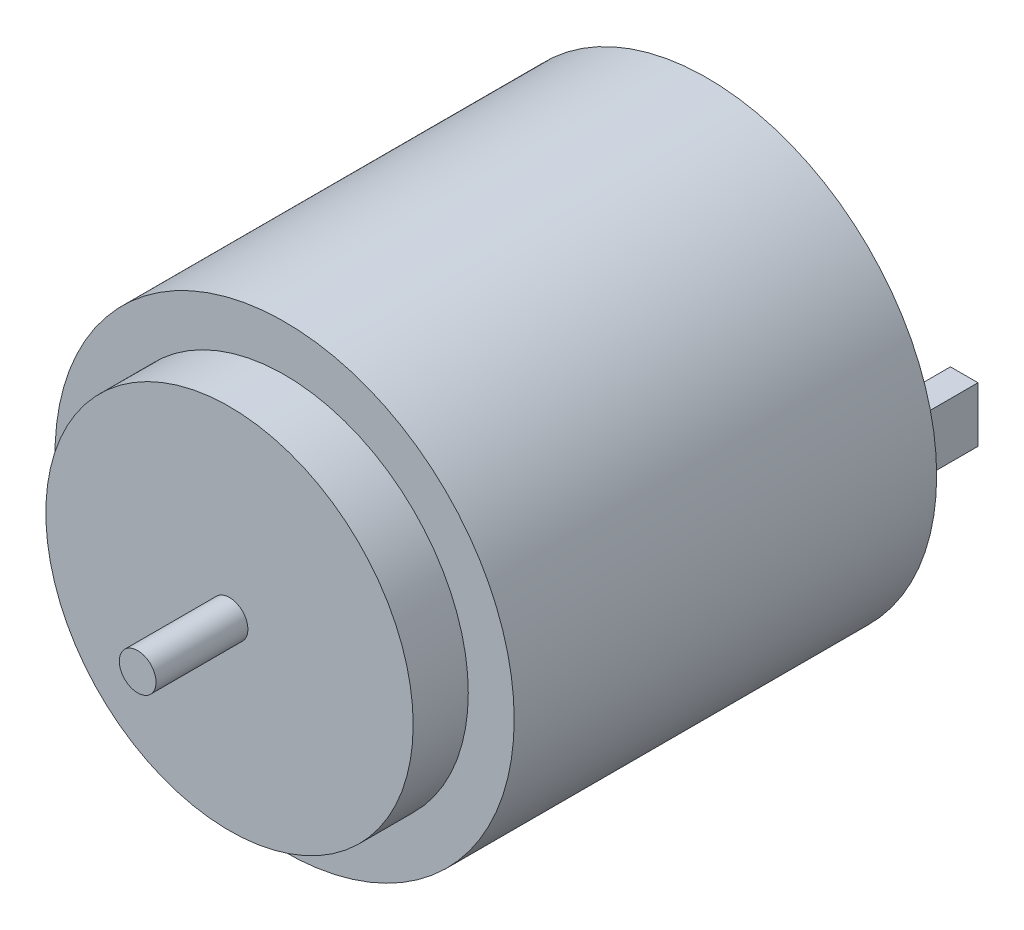
from build123d import *

# Parameters (mm, degrees)
ESQUISSE1_R        = 12.5
BOSS_EXTRU_1_DEPTH = 23
ESQUISSE2_R        = 10
BOSS_EXTRU_2_DEPTH = 3
ESQUISSE3_R        = 1
BOSS_EXTRU_3_DEPTH = 5
ESQUISSE4_W        = 1.5
ESQUISSE4_H        = 3
BOSS_EXTRU_4_DEPTH = 4


with BuildPart() as part:
    # Esquisse1 → Boss.-Extru.1 (new body)
    with BuildSketch(Plane.XY):
        with Locations((-60.780131723, 28.535714286)):
            Circle(ESQUISSE1_R)
    extrude(amount=BOSS_EXTRU_1_DEPTH)

    # Esquisse2 → Boss.-Extru.2 (add)
    with BuildSketch(Plane.XY.offset(23)):
        with Locations((-60.780131723, 28.535714286)):
            Circle(ESQUISSE2_R)
    extrude(amount=BOSS_EXTRU_2_DEPTH)

    # Esquisse3 → Boss.-Extru.3 (add)
    with BuildSketch(Plane.XY.offset(26)):
        with Locations((-60.780131723, 28.535714286)):
            Circle(ESQUISSE3_R)
    extrude(amount=BOSS_EXTRU_3_DEPTH)

    # Esquisse4 → Boss.-Extru.4 (add)
    with BuildSketch(Plane(origin=(0, 0, 0), x_dir=(-1, 0, 0), z_dir=(0, 0, -1))):
        with Locations((70.780131723, 28.535714286)):
            Rectangle(ESQUISSE4_W, ESQUISSE4_H)
        with Locations((50.780131723, 28.535714286)):
            Rectangle(ESQUISSE4_W, ESQUISSE4_H)
    extrude(amount=BOSS_EXTRU_4_DEPTH)


solid = part.part
